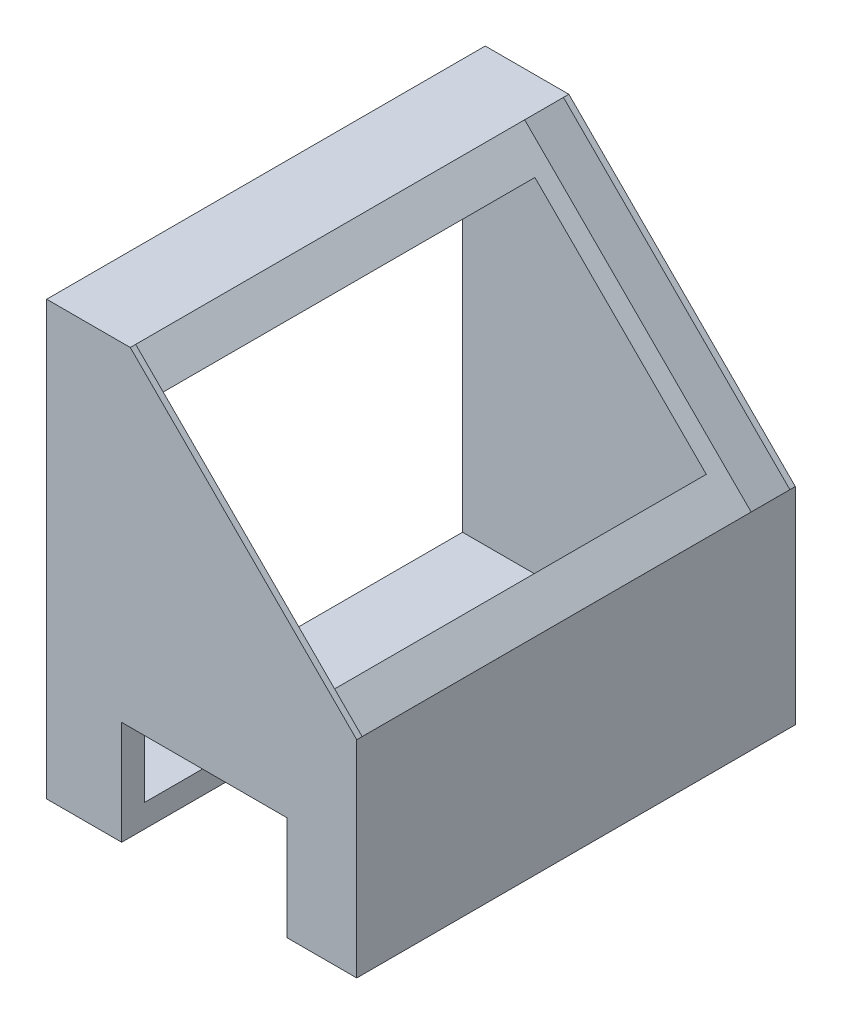
from build123d import *

# Parameters (mm, degrees)
SKETCH1_W               = 150
SKETCH1_H               = 150
BOSS_EXTRUDE2_DEPTH     = 152
CHAMFER1_SIZE           = 78.48885271
SKETCH4_W               = 148.25
SKETCH4_H               = 111
CUT_EXTRUDE5_DEPTH      = 19
SKETCH5_W               = 136.25
SKETCH5_H               = 84
CUT_EXTRUDE6_DEPTH      = 81
CUT_EXTRUDE7_DEPTH      = 20
CUT_EXTRUDE7_DEPTH_BACK = 153
SKETCH6_W               = 42.53672634
SKETCH6_H               = 150
SKETCH7_W               = 136.153133976
SKETCH7_H               = 29.553064713
CUT_EXTRUDE8_DEPTH      = 84
SKETCH8_W               = 136.25
SKETCH8_H               = 30.070372941
CUT_EXTRUDE9_DEPTH      = 30
SKETCH9_W               = 57.3
SKETCH9_H               = 36
CUT_EXTRUDE10_DEPTH     = 74.6


with BuildPart() as part:
    # Sketch1 → Boss-Extrude2 (new body)
    with BuildSketch(Plane.XY):
        with Locations((75, 75)):
            Rectangle(SKETCH1_W, SKETCH1_H)
    extrude(amount=BOSS_EXTRUDE2_DEPTH)

    # Chamfer1
    chamfer1_edges = [part.edges().sort_by_distance(p)[0] for p in [
        (150, 150, 76),
    ]]
    chamfer(chamfer1_edges, length=CHAMFER1_SIZE)

    # Sketch4 → Cut-Extrude5 (cut)
    with BuildSketch(Plane(origin=(110.755573645, 110.755573645, 0), x_dir=(0, 0, -1), z_dir=(0.7071067811865489, 0.7071067811865461, 0))):
        with Locations((-76, 0.001948307)):
            Rectangle(SKETCH4_W, SKETCH4_H)
    extrude(amount=-CUT_EXTRUDE5_DEPTH, mode=Mode.SUBTRACT)

    # Sketch5 → Cut-Extrude6 (cut)
    with BuildSketch(Plane(origin=(97.320544802, 97.320544802, 0), x_dir=(0, 0, -1), z_dir=(0.707106781186549, 0.707106781186546, 0))):
        with Locations((-76, 0.001948307)):
            Rectangle(SKETCH5_W, SKETCH5_H)
    extrude(amount=-CUT_EXTRUDE6_DEPTH, mode=Mode.SUBTRACT)

    # Sketch6 → Cut-Extrude7 (cut, two sides: drawn at the far end of the back side and taken through both)
    with BuildSketch(Plane.XY.offset(152).offset(-CUT_EXTRUDE7_DEPTH_BACK)):
        with Locations((21.26836317, 75)):
            Rectangle(SKETCH6_W, SKETCH6_H)
    extrude(amount=CUT_EXTRUDE7_DEPTH + CUT_EXTRUDE7_DEPTH_BACK, mode=Mode.SUBTRACT)

    # Sketch7 → Cut-Extrude8 (cut)
    with BuildSketch(Plane.ZY.offset(-42.53672634)):
        with Locations((75.951566988, 22.776532357)):
            Rectangle(SKETCH7_W, SKETCH7_H)
    extrude(amount=-CUT_EXTRUDE8_DEPTH, mode=Mode.SUBTRACT)

    # Sketch8 → Cut-Extrude9 (cut)
    with BuildSketch(Plane.ZY.offset(-126.53672634)):
        with Locations((76, 52.588251184)):
            Rectangle(SKETCH8_W, SKETCH8_H)
    extrude(amount=CUT_EXTRUDE9_DEPTH, mode=Mode.SUBTRACT)

    # Sketch9 → Cut-Extrude10 (cut)
    with BuildSketch(Plane.XY.offset(152)):
        with Locations((97.18672634, 18)):
            Rectangle(SKETCH9_W, SKETCH9_H)
    extrude(amount=-CUT_EXTRUDE10_DEPTH, mode=Mode.SUBTRACT)


solid = part.part
